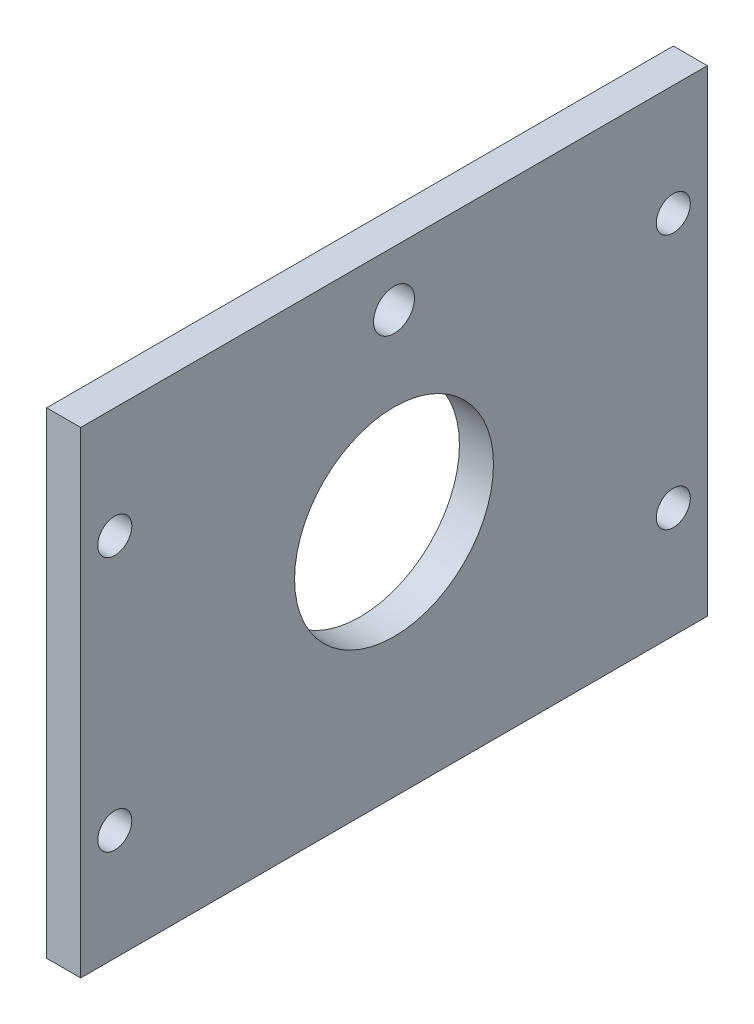
from build123d import *

# Parameters (mm, degrees)
SKETCH1_W               = 92
SKETCH1_H               = 70
SKETCH1_R               = 14.6
BOSS_EXTRUDE1_DEPTH     = 5
CUT_EXTRUDE1_DEPTH      = 116.71084651
CUT_EXTRUDE1_DEPTH_BACK = 116.71084651
SKETCH2_R               = 2.5
CUT_EXTRUDE2_DEPTH      = 116.71084651
CUT_EXTRUDE2_DEPTH_BACK = 116.71084651
SKETCH3_R               = 3


with BuildPart() as part:
    # Sketch1 → Boss-Extrude1 (new body)
    with BuildSketch(Plane(origin=(0, 0, 0), x_dir=(0, 0, -1), z_dir=(1, 0, 0))):
        with Locations((46, -35)):
            Rectangle(SKETCH1_W, SKETCH1_H)
        with Locations((46, -35)):
            Circle(SKETCH1_R, mode=Mode.SUBTRACT)
    extrude(amount=BOSS_EXTRUDE1_DEPTH)

    # Sketch2 → Cut-Extrude1 (cut, two sides: drawn at the far end of the back side and taken through both)
    with BuildSketch(Plane(origin=(5, 0, 0), x_dir=(0, 0, -1), z_dir=(1, 0, 0)).offset(-CUT_EXTRUDE1_DEPTH_BACK)):
        with Locations((5, -53.727554141)):
            Circle(SKETCH2_R)
        with Locations((5, -16.272445859)):
            Circle(SKETCH2_R)
        with Locations((87, -53.727554141)):
            Circle(SKETCH2_R)
        with Locations((87, -16.272445859)):
            Circle(SKETCH2_R)
    extrude(amount=CUT_EXTRUDE1_DEPTH + CUT_EXTRUDE1_DEPTH_BACK, mode=Mode.SUBTRACT)

    # Sketch3 → Cut-Extrude2 (cut, two sides: drawn at the far end of the back side and taken through both)
    with BuildSketch(Plane.ZY.offset(-CUT_EXTRUDE2_DEPTH_BACK)):
        with Locations((-46, -8.059478057)):
            Circle(SKETCH3_R)
    extrude(amount=CUT_EXTRUDE2_DEPTH + CUT_EXTRUDE2_DEPTH_BACK, mode=Mode.SUBTRACT)


solid = part.part
